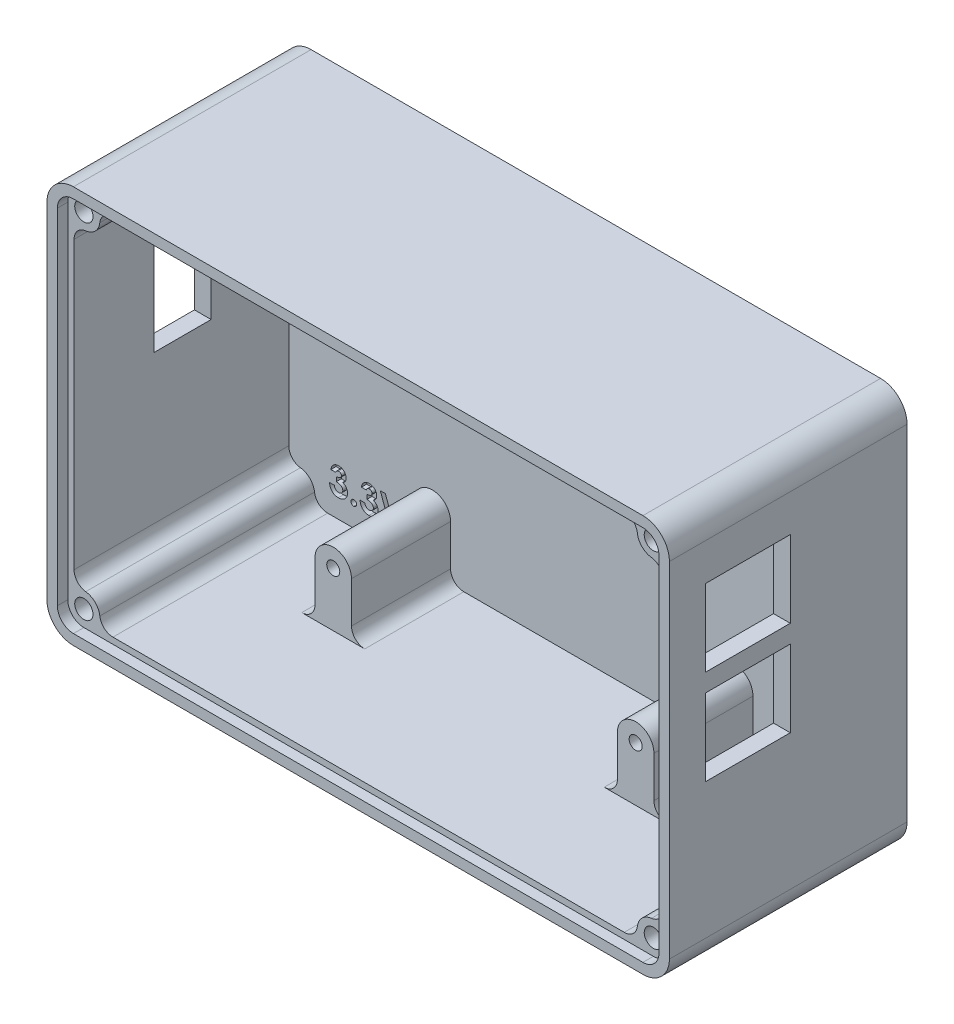
from build123d import *

# Parameters (mm, degrees)
ENCLOSURE_BASE_DEPTH      = 2.400000026
ENCLOSURE_START           = 2.4
ENCLOSURE_WALL_DEPTH      = 43.18
SKETCH6_R                 = 1.25000004
ODROID_MOUNT_SPACER_DEPTH = 19.0000001
SKETCH7_W                 = 11.000000098
SKETCH7_H                 = 26.00000007
POWER_SWITCH_HOLE_DEPTH   = 7.112
SKETCH8_W                 = 0.569871795
SKETCH8_H                 = 2.320192308
LABELING_DEPTH            = 1.000000032
TOP_START                 = -2.000000064
TOP_COVER_GROOVE_DEPTH    = 2.000000064
SKETCH10_R                = 3.079999936
SKETCH10_R_2              = 1.750000056
BOSS_EXTRUDE4_DEPTH       = 43.579999962
FILLET1_R                 = 2.54
FILLET2_R                 = 2.54
CUT_EXTRUDE2_REACH        = 135.344
SKETCH17_W                = 16.256
SKETCH17_H                = 14.732


with BuildPart() as part:
    # Sketch5 → Enclosure Base (new body)
    with BuildSketch(Plane.XY):
        with BuildLine():
            Line((44.569600274, -38.1), (-64.650399726, -38.1))
            ThreePointArc((-64.650399726, -38.1), (-68.242502174, -36.612102448), (-69.730399726, -33.02))
            Line((-69.730399726, -33.02), (-69.730399726, 33.02))
            ThreePointArc((-69.730399726, 33.02), (-68.242502174, 36.612102448), (-64.650399726, 38.1))
            Line((-64.650399726, 38.1), (44.569600274, 38.1))
            ThreePointArc((44.569600274, 38.1), (48.161702723, 36.612102448), (49.649600274, 33.02))
            Line((49.649600274, 33.02), (49.649600274, -33.02))
            ThreePointArc((49.649600274, -33.02), (48.161702723, -36.612102448), (44.569600274, -38.1))
        make_face()
    extrude(amount=ENCLOSURE_BASE_DEPTH)

    # Sketch5<3> → Enclosure Wall (add)
    with BuildSketch(Plane.XY.offset(ENCLOSURE_START)):
        with BuildLine():
            Line((44.569600274, 38.1), (-64.650399726, 38.1))
            ThreePointArc((-64.650399726, 38.1), (-68.242502174, 36.612102448), (-69.730399726, 33.02))
            Line((-69.730399726, 33.02), (-69.730399726, -33.02))
            ThreePointArc((-69.730399726, -33.02), (-68.242502174, -36.612102448), (-64.650399726, -38.1))
            Line((-64.650399726, -38.1), (44.569600274, -38.1))
            ThreePointArc((44.569600274, -38.1), (48.161702723, -36.612102448), (49.649600274, -33.02))
            Line((49.649600274, -33.02), (49.649600274, 33.02))
            ThreePointArc((49.649600274, 33.02), (48.161702723, 36.612102448), (44.569600274, 38.1))
        make_face()
        with BuildLine():
            ThreePointArc((46.449600324, 33.02), (45.898961058, 34.349360784), (44.569600274, 34.90000005))
            Line((44.569600274, 34.90000005), (-64.650399726, 34.90000005))
            ThreePointArc((-64.650399726, 34.90000005), (-65.97976051, 34.349360784), (-66.530399776, 33.02))
            Line((-66.530399776, 33.02), (-66.530399776, -33.02))
            ThreePointArc((-66.530399776, -33.02), (-65.97976051, -34.349360784), (-64.650399726, -34.90000005))
            Line((-64.650399726, -34.90000005), (44.569600274, -34.90000005))
            ThreePointArc((44.569600274, -34.90000005), (45.898961058, -34.349360784), (46.449600324, -33.02))
            Line((46.449600324, -33.02), (46.449600324, 33.02))
        make_face(mode=Mode.SUBTRACT)
    extrude(amount=ENCLOSURE_WALL_DEPTH)

    # Sketch6 → Odroid Mount Spacer (add)
    # profile 1 of 4: a face of its own
    with BuildSketch(Plane.XY.offset(2.400000026)):
        with BuildLine():
            Line((-35.499999993, 24.500000149), (-35.499999993, 34.90000005))
            Line((-35.499999993, 34.90000005), (-42.499999709, 34.90000005))
            Line((-42.499999709, 34.90000005), (-42.499999709, 24.499999895))
            ThreePointArc((-42.499999709, 24.499999895), (-38.999999724, 21.000000291), (-35.499999993, 24.500000149))
        make_face()
        with Locations((-38.999999851, 24.500000149)):
            Circle(SKETCH6_R, mode=Mode.SUBTRACT)
    # profile 2 of 4: a face of its own
    with BuildSketch(Plane.XY.offset(2.400000026)):
        with BuildLine():
            Line((15.500000369, 24.500000149), (15.500000369, 34.90000005))
            Line((15.500000369, 34.90000005), (22.500000085, 34.90000005))
            Line((22.500000085, 34.90000005), (22.500000085, 24.500000149))
            ThreePointArc((22.500000085, 24.500000149), (19.000000227, 21.000000291), (15.500000369, 24.500000149))
        make_face()
        with Locations((19.000000227, 24.500000149)):
            Circle(SKETCH6_R, mode=Mode.SUBTRACT)
    # profile 3 of 4: a face of its own
    with BuildSketch(Plane.XY.offset(2.400000026)):
        with BuildLine():
            Line((15.500000369, -24.500000149), (15.500000369, -34.90000005))
            Line((15.500000369, -34.90000005), (22.500000085, -34.90000005))
            Line((22.500000085, -34.90000005), (22.500000085, -24.500000149))
            ThreePointArc((22.500000085, -24.500000149), (19.000000227, -21.000000037), (15.500000369, -24.500000149))
        make_face()
        with Locations((19.000000227, -24.499999895)):
            Circle(SKETCH6_R, mode=Mode.SUBTRACT)
    # profile 4 of 4: a face of its own
    with BuildSketch(Plane.XY.offset(2.400000026)):
        with BuildLine():
            Line((-42.499999709, -34.90000005), (-42.499999709, -24.499999895))
            ThreePointArc((-42.499999709, -24.499999895), (-38.999999724, -21.000000037), (-35.499999993, -24.500000149))
            Line((-35.499999993, -24.500000149), (-35.499999993, -34.90000005))
            Line((-35.499999993, -34.90000005), (-42.499999709, -34.90000005))
        make_face()
        with Locations((-38.999999851, -24.499999895)):
            Circle(SKETCH6_R, mode=Mode.SUBTRACT)
    extrude(amount=ODROID_MOUNT_SPACER_DEPTH)

    # Sketch7 → Power Switch Hole (cut)
    with BuildSketch(Plane.ZY.offset(69.730399726)):
        with Locations((22.790000013, 13.974684289)):
            Rectangle(SKETCH7_W, SKETCH7_H)
    extrude(amount=-POWER_SWITCH_HOLE_DEPTH, mode=Mode.SUBTRACT)

    # Sketch8 → Labeling (cut)
    # profile 1 of 12: a face of its own
    with BuildSketch(Plane.XY.offset(2.400000026)):
        with BuildLine():
            Line((-57.542707468, -27.351052951), (-58.45450234, -27.351052951))
            add(Edge.make_bspline(
                [(-58.45450234, -27.351052951), (-58.448064721, -27.305475578), (-58.435444196, -27.216124157), (-58.405244969, -27.086765559), (-58.369123433, -26.964060076), (-58.324027542, -26.848396291), (-58.271137398, -26.739568168), (-58.210990834, -26.637202263), (-58.142937645, -26.541737949), (-58.090774155, -26.484229867), (-58.064750737, -26.45554013)],
                knots=[0, 0, 0, 0, 1.111473889, 2.178970933, 3.205615836, 4.199322666, 5.174200091, 6.12565194, 7.064921805, 8, 8, 8, 8], degree=3))
            add(Edge.make_bspline(
                [(-58.064750737, -26.45554013), (-58.027215406, -26.417686101), (-57.953237212, -26.343079787), (-57.829610973, -26.247517341), (-57.700027844, -26.164814542), (-57.561888978, -26.099247165), (-57.41734392, -26.046177969), (-57.265243198, -26.01053127), (-57.10620835, -25.986879371), (-56.997687073, -25.984549577), (-56.942306827, -25.983360643)],
                knots=[0, 0, 0, 0, 1.01925491, 2.00884431, 2.983262333, 3.955970413, 4.92937149, 5.924503185, 6.940838805, 8, 8, 8, 8], degree=3))
            add(Edge.make_bspline(
                [(-56.942306827, -25.983360643), (-56.893070938, -25.984523006), (-56.796283103, -25.986807977), (-56.654029338, -26.005150485), (-56.518402278, -26.037321202), (-56.387968305, -26.079383693), (-56.264645678, -26.136616742), (-56.145712547, -26.203052129), (-56.034491908, -26.284537893), (-55.930723525, -26.376608605), (-55.835392475, -26.476192094), (-55.752835367, -26.582638654), (-55.681859541, -26.693104851), (-55.623384848, -26.808508453), (-55.578425755, -26.929044734), (-55.547222811, -27.054017373), (-55.526799727, -27.183150609), (-55.524765054, -27.270920731), (-55.523733109, -27.315435963)],
                knots=[0, 0, 0, 0, 1.091422571, 2.145516843, 3.172569842, 4.178562979, 5.178154469, 6.181868002, 7.194278174, 8.227918432, 9.254613415, 10.245994977, 11.209837596, 12.161663635, 13.10878368, 14.055455738, 15.013766427, 16, 16, 16, 16], degree=3))
            add(Edge.make_bspline(
                [(-55.523733109, -27.315435963), (-55.525850722, -27.370564372), (-55.53001965, -27.47909526), (-55.564228726, -27.637938279), (-55.617775233, -27.789820551), (-55.69512837, -27.932617015), (-55.791839492, -28.06593906), (-55.910500801, -28.18532933), (-56.047732513, -28.292659702), (-56.150754187, -28.350339057), (-56.20350875, -28.379875066)],
                knots=[0, 0, 0, 0, 0.992805628, 1.954529043, 2.915727527, 3.886831945, 4.871318353, 5.87440735, 6.911542536, 8, 8, 8, 8], degree=3))
            add(Edge.make_bspline(
                [(-56.20350875, -28.379875066), (-56.167298828, -28.391763546), (-56.096147954, -28.415123876), (-55.995015542, -28.461131781), (-55.898850175, -28.511410796), (-55.809307785, -28.569821757), (-55.725497765, -28.634002784), (-55.647931031, -28.704502519), (-55.57614414, -28.781167241), (-55.511308983, -28.864418576), (-55.453765248, -28.952925081), (-55.402134319, -29.044642309), (-55.359639186, -29.140961167), (-55.323640518, -29.240781629), (-55.296233182, -29.34500083), (-55.276935968, -29.453214928), (-55.265781705, -29.565177079), (-55.26408049, -29.641031369), (-55.263220288, -29.679386284)],
                knots=[0, 0, 0, 0, 1.059543567, 2.081955587, 3.086750234, 4.076226789, 5.052108497, 6.020845489, 6.989030705, 7.970690546, 8.952259656, 9.923888338, 10.895517021, 11.877585046, 12.873342345, 13.889638361, 14.932918083, 16, 16, 16, 16], degree=3))
            add(Edge.make_bspline(
                [(-55.263220288, -29.679386284), (-55.264964032, -29.735752436), (-55.26840234, -29.846895009), (-55.290261493, -30.010596645), (-55.330959296, -30.16667161), (-55.384499511, -30.316915783), (-55.455916347, -30.459389566), (-55.539961956, -30.597362539), (-55.643270896, -30.726049836), (-55.758081044, -30.848853616), (-55.885584407, -30.960501314), (-56.023818795, -31.057294844), (-56.169744553, -31.140360915), (-56.324284911, -31.207796318), (-56.487386179, -31.25972929), (-56.658684818, -31.297268837), (-56.838900578, -31.320236153), (-56.961911935, -31.32264384), (-57.024734712, -31.323873463)],
                knots=[0, 0, 0, 0, 1.005138573, 1.981928558, 2.936866704, 3.876260664, 4.820238198, 5.773547, 6.751179199, 7.756627054, 8.768222608, 9.766606018, 10.760583154, 11.757261445, 12.767156078, 13.807575856, 14.880313354, 16, 16, 16, 16], degree=3))
            add(Edge.make_bspline(
                [(-57.024734712, -31.323873463), (-57.084164045, -31.322577034), (-57.200370243, -31.320042037), (-57.370346129, -31.298100354), (-57.531892119, -31.262706639), (-57.685420481, -31.212816262), (-57.830337226, -31.14811697), (-57.967956517, -31.071074631), (-58.095532189, -30.97724562), (-58.214485688, -30.870865557), (-58.322178266, -30.751513167), (-58.41843007, -30.621953189), (-58.50111873, -30.481692958), (-58.570583354, -30.331331726), (-58.626280886, -30.170605712), (-58.670214935, -29.999841763), (-58.700903588, -29.818706257), (-58.710249881, -29.694081176), (-58.71501516, -29.63054013)],
                knots=[0, 0, 0, 0, 1.066544725, 2.085487077, 3.070979577, 4.031932826, 4.977951092, 5.916076795, 6.857635327, 7.814973522, 8.776389752, 9.738577119, 10.707772778, 11.69409279, 12.707140348, 13.757286496, 14.856535458, 16, 16, 16, 16], degree=3))
            Line((-58.71501516, -29.63054013), (-57.803220288, -29.63054013))
            add(Edge.make_bspline(
                [(-57.803220288, -29.63054013), (-57.797442339, -29.662489402), (-57.786188268, -29.724718988), (-57.764237893, -29.814813594), (-57.735633492, -29.89797648), (-57.702559687, -29.974946796), (-57.666834999, -30.046735134), (-57.623671032, -30.110690175), (-57.576230617, -30.168548559), (-57.507773751, -30.237331243), (-57.409909945, -30.30800258), (-57.277761387, -30.369419334), (-57.13075863, -30.405417098), (-57.027989041, -30.409808714), (-56.974870929, -30.412078592)],
                knots=[0, 0, 0, 0, 0.928156231, 1.807827665, 2.648129825, 3.438902246, 4.202261636, 4.936546065, 5.639352463, 6.338805438, 7.70633318, 9.064371875, 10.482673459, 12, 12, 12, 12], degree=3))
            add(Edge.make_bspline(
                [(-56.974870929, -30.412078592), (-56.946684582, -30.411595243), (-56.891473832, -30.41064847), (-56.810377462, -30.400154763), (-56.733121751, -30.382871619), (-56.659562807, -30.359384468), (-56.589232348, -30.329941855), (-56.523474108, -30.291977368), (-56.46094777, -30.247838232), (-56.402333053, -30.198214125), (-56.348171847, -30.144141613), (-56.303106537, -30.084265493), (-56.261920106, -30.023420652), (-56.231458324, -29.957626408), (-56.204767241, -29.890423194), (-56.188430935, -29.819371743), (-56.17609585, -29.745962524), (-56.175378984, -29.695724477), (-56.17501516, -29.67022763)],
                knots=[0, 0, 0, 0, 1.110435564, 2.175094844, 3.216326037, 4.226890168, 5.215276772, 6.21526065, 7.213097102, 8.228249917, 9.239874822, 10.221364777, 11.178138315, 12.128914389, 13.072518965, 14.022636769, 14.996447288, 16, 16, 16, 16], degree=3))
            add(Edge.make_bspline(
                [(-56.17501516, -29.67022763), (-56.175981045, -29.642342484), (-56.177903901, -29.586829547), (-56.193613832, -29.505820088), (-56.218423134, -29.427895518), (-56.252886285, -29.353400923), (-56.298907982, -29.282610875), (-56.353213071, -29.214105111), (-56.420079895, -29.151449236), (-56.493441756, -29.089515801), (-56.578512694, -29.035528526), (-56.671149636, -28.985706202), (-56.773787224, -28.946063015), (-56.883919983, -28.910654305), (-57.003631177, -28.884792334), (-57.132177443, -28.866014022), (-57.269351419, -28.852036479), (-57.363907223, -28.85003117), (-57.412451058, -28.849001669)],
                knots=[0, 0, 0, 0, 0.809814727, 1.612155564, 2.388397, 3.182215007, 3.988903953, 4.837162975, 5.715530372, 6.646997145, 7.623086902, 8.637258368, 9.698941581, 10.815059213, 11.996518529, 13.252603015, 14.589518788, 16, 16, 16, 16], degree=3))
            Line((-57.412451058, -28.849001669), (-57.412451058, -28.002335002))
            add(Edge.make_bspline(
                [(-57.412451058, -28.002335002), (-57.352011096, -27.997187741), (-57.238939898, -27.987558236), (-57.081991012, -27.965039304), (-56.949860282, -27.934939044), (-56.839371943, -27.898624708), (-56.747629506, -27.851987641), (-56.667483819, -27.800502379), (-56.598458563, -27.74070977), (-56.540122962, -27.674392824), (-56.493456296, -27.603174642), (-56.460428349, -27.528162166), (-56.438618418, -27.451676376), (-56.436551928, -27.3993624), (-56.435527981, -27.373440771)],
                knots=[0, 0, 0, 0, 1.70044513, 3.18119609, 4.440695891, 5.496282586, 6.431922213, 7.318171381, 8.16090191, 8.983045123, 9.787564368, 10.536848927, 11.275007137, 12, 12, 12, 12], degree=3))
            add(Edge.make_bspline(
                [(-56.435527981, -27.373440771), (-56.437294583, -27.340367587), (-56.440742618, -27.275815735), (-56.467521921, -27.183428435), (-56.514007757, -27.101072815), (-56.5763371, -27.028922173), (-56.652287572, -26.96865655), (-56.741314839, -26.924904735), (-56.841487005, -26.89919859), (-56.911963522, -26.896533729), (-56.948412596, -26.895155515)],
                knots=[0, 0, 0, 0, 1.009664648, 1.970651636, 2.907870547, 3.878035693, 4.867062054, 5.849714035, 6.887914197, 8, 8, 8, 8], degree=3))
            add(Edge.make_bspline(
                [(-56.948412596, -26.895155515), (-56.981449584, -26.896781662), (-57.047005087, -26.900008437), (-57.142866853, -26.924092229), (-57.233903593, -26.964634297), (-57.318230194, -27.020539418), (-57.394629382, -27.087679099), (-57.457331074, -27.167192115), (-57.509483368, -27.254314703), (-57.531589352, -27.318680455), (-57.542707468, -27.351052951)],
                knots=[0, 0, 0, 0, 0.98818071, 1.960853194, 2.938124878, 3.957524365, 4.978590984, 5.968022688, 6.978025184, 8, 8, 8, 8], degree=3))
        make_face()
    # profile 2 of 12: a face of its own
    with BuildSketch(Plane.XY.offset(2.400000026)):
        with BuildLine():
            add(Edge.make_bspline(
                [(-54.058348494, -30.151565771), (-54.021540416, -30.15358387), (-53.949071667, -30.157557157), (-53.844364207, -30.187209385), (-53.749865121, -30.240483837), (-53.665370312, -30.309971126), (-53.593923629, -30.393573612), (-53.542283582, -30.488912026), (-53.51012603, -30.593216034), (-53.506575814, -30.665912778), (-53.50475875, -30.703120258)],
                knots=[0, 0, 0, 0, 1.016957001, 2.002212695, 2.9757545, 3.99499976, 5.013036768, 5.994806404, 6.97370641, 8, 8, 8, 8], degree=3))
            add(Edge.make_bspline(
                [(-53.50475875, -30.703120258), (-53.50656391, -30.740333715), (-53.510090869, -30.813042134), (-53.542506109, -30.917549386), (-53.593846462, -31.013671394), (-53.665376044, -31.098169736), (-53.749515199, -31.168966578), (-53.844581477, -31.221749762), (-53.948872202, -31.253084085), (-54.021505307, -31.256840045), (-54.058348494, -31.258745258)],
                knots=[0, 0, 0, 0, 1.023218912, 1.999186227, 2.986238111, 4.008388923, 5.030539734, 6.0011649, 6.986089706, 8, 8, 8, 8], degree=3))
            add(Edge.make_bspline(
                [(-54.058348494, -31.258745258), (-54.09520041, -31.256855538), (-54.167850726, -31.25313012), (-54.272303563, -31.221485644), (-54.368071694, -31.169318979), (-54.452231989, -31.09808386), (-54.524081134, -31.01397061), (-54.573961833, -30.917246104), (-54.606679012, -30.813081534), (-54.610157755, -30.740347054), (-54.611938237, -30.703120258)],
                knots=[0, 0, 0, 0, 1.013427518, 1.99788335, 2.976245624, 3.997909735, 5.019573847, 6.001765691, 6.977268297, 8, 8, 8, 8], degree=3))
            add(Edge.make_bspline(
                [(-54.611938237, -30.703120258), (-54.610146008, -30.665899207), (-54.606644315, -30.593175947), (-54.574183726, -30.489218801), (-54.524001191, -30.39327277), (-54.452237981, -30.310057181), (-54.367719969, -30.240134187), (-54.272522052, -30.187469883), (-54.167651361, -30.157510782), (-54.095165343, -30.153568249), (-54.058348494, -30.151565771)],
                knots=[0, 0, 0, 0, 1.025808215, 2.00424526, 2.981110158, 3.998665696, 5.017428914, 5.998734231, 6.983523959, 8, 8, 8, 8], degree=3))
        make_face()
    # profile 3 of 12: a face of its own
    with BuildSketch(Plane.XY.offset(2.400000026)):
        with BuildLine():
            Line((-51.681169006, -27.351052951), (-52.592963878, -27.351052951))
            add(Edge.make_bspline(
                [(-52.592963878, -27.351052951), (-52.58652626, -27.305475578), (-52.573905735, -27.216124157), (-52.543706507, -27.086765559), (-52.507584972, -26.964060076), (-52.46248908, -26.848396291), (-52.409598936, -26.739568168), (-52.349452373, -26.637202263), (-52.281399184, -26.541737949), (-52.229235693, -26.484229867), (-52.203212276, -26.45554013)],
                knots=[0, 0, 0, 0, 1.111473889, 2.178970933, 3.205615836, 4.199322666, 5.174200091, 6.12565194, 7.064921805, 8, 8, 8, 8], degree=3))
            add(Edge.make_bspline(
                [(-52.203212276, -26.45554013), (-52.165676944, -26.417686101), (-52.09169875, -26.343079787), (-51.968072511, -26.247517341), (-51.838489382, -26.164814542), (-51.700350516, -26.099247165), (-51.555805459, -26.046177969), (-51.403704737, -26.01053127), (-51.244669889, -25.986879371), (-51.136148612, -25.984549577), (-51.080768365, -25.983360643)],
                knots=[0, 0, 0, 0, 1.01925491, 2.00884431, 2.983262333, 3.955970413, 4.92937149, 5.924503185, 6.940838805, 8, 8, 8, 8], degree=3))
            add(Edge.make_bspline(
                [(-51.080768365, -25.983360643), (-51.031532477, -25.984523006), (-50.934744641, -25.986807977), (-50.792490876, -26.005150485), (-50.656863816, -26.037321202), (-50.526429843, -26.079383693), (-50.403107216, -26.136616742), (-50.284174085, -26.203052129), (-50.172953446, -26.284537893), (-50.069185064, -26.376608605), (-49.973854013, -26.476192094), (-49.891296906, -26.582638654), (-49.820321079, -26.693104851), (-49.761846386, -26.808508453), (-49.716887293, -26.929044734), (-49.68568435, -27.054017373), (-49.665261265, -27.183150609), (-49.663226592, -27.270920731), (-49.662194647, -27.315435963)],
                knots=[0, 0, 0, 0, 1.091422571, 2.145516843, 3.172569842, 4.178562979, 5.178154469, 6.181868002, 7.194278174, 8.227918432, 9.254613415, 10.245994977, 11.209837596, 12.161663635, 13.10878368, 14.055455738, 15.013766427, 16, 16, 16, 16], degree=3))
            add(Edge.make_bspline(
                [(-49.662194647, -27.315435963), (-49.66431226, -27.370564372), (-49.668481189, -27.47909526), (-49.702690265, -27.637938279), (-49.756236771, -27.789820551), (-49.833589908, -27.932617015), (-49.930301031, -28.06593906), (-50.048962339, -28.18532933), (-50.186194052, -28.292659702), (-50.289215726, -28.350339057), (-50.341970288, -28.379875066)],
                knots=[0, 0, 0, 0, 0.992805628, 1.954529043, 2.915727527, 3.886831945, 4.871318353, 5.87440735, 6.911542536, 8, 8, 8, 8], degree=3))
            add(Edge.make_bspline(
                [(-50.341970288, -28.379875066), (-50.305760366, -28.391763546), (-50.234609492, -28.415123876), (-50.133477081, -28.461131781), (-50.037311714, -28.511410796), (-49.947769323, -28.569821757), (-49.863959304, -28.634002784), (-49.78639257, -28.704502519), (-49.714605678, -28.781167241), (-49.649770522, -28.864418576), (-49.592226787, -28.952925081), (-49.540595858, -29.044642309), (-49.498100725, -29.140961167), (-49.462102057, -29.240781629), (-49.434694721, -29.34500083), (-49.415397507, -29.453214928), (-49.404243244, -29.565177079), (-49.402542028, -29.641031369), (-49.401681827, -29.679386284)],
                knots=[0, 0, 0, 0, 1.059543567, 2.081955587, 3.086750234, 4.076226789, 5.052108497, 6.020845489, 6.989030705, 7.970690546, 8.952259656, 9.923888338, 10.895517021, 11.877585046, 12.873342345, 13.889638361, 14.932918083, 16, 16, 16, 16], degree=3))
            add(Edge.make_bspline(
                [(-49.401681827, -29.679386284), (-49.403425571, -29.735752436), (-49.406863879, -29.846895009), (-49.428723031, -30.010596645), (-49.469420835, -30.16667161), (-49.522961049, -30.316915783), (-49.594377885, -30.459389566), (-49.678423494, -30.597362539), (-49.781732434, -30.726049836), (-49.896542583, -30.848853616), (-50.024045946, -30.960501314), (-50.162280334, -31.057294844), (-50.308206092, -31.140360915), (-50.46274645, -31.207796318), (-50.625847718, -31.25972929), (-50.797146357, -31.297268837), (-50.977362117, -31.320236153), (-51.100373473, -31.32264384), (-51.16319625, -31.323873463)],
                knots=[0, 0, 0, 0, 1.005138573, 1.981928558, 2.936866704, 3.876260664, 4.820238198, 5.773547, 6.751179199, 7.756627054, 8.768222608, 9.766606018, 10.760583154, 11.757261445, 12.767156078, 13.807575856, 14.880313354, 16, 16, 16, 16], degree=3))
            add(Edge.make_bspline(
                [(-51.16319625, -31.323873463), (-51.222625584, -31.322577034), (-51.338831782, -31.320042037), (-51.508807667, -31.298100354), (-51.670353657, -31.262706639), (-51.823882019, -31.212816262), (-51.968798765, -31.14811697), (-52.106418055, -31.071074631), (-52.233993728, -30.97724562), (-52.352947227, -30.870865557), (-52.460639805, -30.751513167), (-52.556891608, -30.621953189), (-52.639580269, -30.481692958), (-52.709044893, -30.331331726), (-52.764742424, -30.170605712), (-52.808676474, -29.999841763), (-52.839365126, -29.818706257), (-52.84871142, -29.694081176), (-52.853476699, -29.63054013)],
                knots=[0, 0, 0, 0, 1.066544725, 2.085487077, 3.070979577, 4.031932826, 4.977951092, 5.916076795, 6.857635327, 7.814973522, 8.776389752, 9.738577119, 10.707772778, 11.69409279, 12.707140348, 13.757286496, 14.856535458, 16, 16, 16, 16], degree=3))
            Line((-52.853476699, -29.63054013), (-51.941681827, -29.63054013))
            add(Edge.make_bspline(
                [(-51.941681827, -29.63054013), (-51.935903878, -29.662489402), (-51.924649807, -29.724718988), (-51.902699432, -29.814813594), (-51.87409503, -29.89797648), (-51.841021226, -29.974946796), (-51.805296537, -30.046735134), (-51.762132571, -30.110690175), (-51.714692155, -30.168548559), (-51.646235289, -30.237331243), (-51.548371484, -30.30800258), (-51.416222925, -30.369419334), (-51.269220168, -30.405417098), (-51.16645058, -30.409808714), (-51.113332468, -30.412078592)],
                knots=[0, 0, 0, 0, 0.928156231, 1.807827665, 2.648129825, 3.438902246, 4.202261636, 4.936546065, 5.639352463, 6.338805438, 7.70633318, 9.064371875, 10.482673459, 12, 12, 12, 12], degree=3))
            add(Edge.make_bspline(
                [(-51.113332468, -30.412078592), (-51.08514612, -30.411595243), (-51.029935371, -30.41064847), (-50.948839001, -30.400154763), (-50.87158329, -30.382871619), (-50.798024345, -30.359384468), (-50.727693886, -30.329941855), (-50.661935646, -30.291977368), (-50.599409309, -30.247838232), (-50.540794592, -30.198214125), (-50.486633385, -30.144141613), (-50.441568076, -30.084265493), (-50.400381644, -30.023420652), (-50.369919863, -29.957626408), (-50.343228779, -29.890423194), (-50.326892473, -29.819371743), (-50.314557388, -29.745962524), (-50.313840523, -29.695724477), (-50.313476699, -29.67022763)],
                knots=[0, 0, 0, 0, 1.110435564, 2.175094844, 3.216326037, 4.226890168, 5.215276772, 6.21526065, 7.213097102, 8.228249917, 9.239874822, 10.221364777, 11.178138315, 12.128914389, 13.072518965, 14.022636769, 14.996447288, 16, 16, 16, 16], degree=3))
            add(Edge.make_bspline(
                [(-50.313476699, -29.67022763), (-50.314442584, -29.642342484), (-50.316365439, -29.586829547), (-50.33207537, -29.505820088), (-50.356884672, -29.427895518), (-50.391347823, -29.353400923), (-50.43736952, -29.282610875), (-50.491674609, -29.214105111), (-50.558541433, -29.151449236), (-50.631903294, -29.089515801), (-50.716974232, -29.035528526), (-50.809611174, -28.985706202), (-50.912248762, -28.946063015), (-51.022381521, -28.910654305), (-51.142092715, -28.884792334), (-51.270638982, -28.866014022), (-51.407812957, -28.852036479), (-51.502368761, -28.85003117), (-51.550912596, -28.849001669)],
                knots=[0, 0, 0, 0, 0.809814727, 1.612155564, 2.388397, 3.182215007, 3.988903953, 4.837162975, 5.715530372, 6.646997145, 7.623086902, 8.637258368, 9.698941581, 10.815059213, 11.996518529, 13.252603015, 14.589518788, 16, 16, 16, 16], degree=3))
            Line((-51.550912596, -28.849001669), (-51.550912596, -28.002335002))
            add(Edge.make_bspline(
                [(-51.550912596, -28.002335002), (-51.490472635, -27.997187741), (-51.377401437, -27.987558236), (-51.220452551, -27.965039304), (-51.088321821, -27.934939044), (-50.977833482, -27.898624708), (-50.886091044, -27.851987641), (-50.805945358, -27.800502379), (-50.736920101, -27.74070977), (-50.6785845, -27.674392824), (-50.631917834, -27.603174642), (-50.598889887, -27.528162166), (-50.577079956, -27.451676376), (-50.575013467, -27.3993624), (-50.573989519, -27.373440771)],
                knots=[0, 0, 0, 0, 1.70044513, 3.18119609, 4.440695891, 5.496282586, 6.431922213, 7.318171381, 8.16090191, 8.983045123, 9.787564368, 10.536848927, 11.275007137, 12, 12, 12, 12], degree=3))
            add(Edge.make_bspline(
                [(-50.573989519, -27.373440771), (-50.575756122, -27.340367587), (-50.579204156, -27.275815735), (-50.605983459, -27.183428435), (-50.652469295, -27.101072815), (-50.714798638, -27.028922173), (-50.79074911, -26.96865655), (-50.879776378, -26.924904735), (-50.979948544, -26.89919859), (-51.05042506, -26.896533729), (-51.086874135, -26.895155515)],
                knots=[0, 0, 0, 0, 1.009664648, 1.970651636, 2.907870547, 3.878035693, 4.867062054, 5.849714035, 6.887914197, 8, 8, 8, 8], degree=3))
            add(Edge.make_bspline(
                [(-51.086874135, -26.895155515), (-51.119911122, -26.896781662), (-51.185466625, -26.900008437), (-51.281328392, -26.924092229), (-51.372365132, -26.964634297), (-51.456691732, -27.020539418), (-51.533090921, -27.087679099), (-51.595792612, -27.167192115), (-51.647944907, -27.254314703), (-51.670050891, -27.318680455), (-51.681169006, -27.351052951)],
                knots=[0, 0, 0, 0, 0.98818071, 1.960853194, 2.938124878, 3.957524365, 4.978590984, 5.968022688, 6.978025184, 8, 8, 8, 8], degree=3))
        make_face()
    # profile 4 of 12: a face of its own
    with BuildSketch(Plane.XY.offset(2.400000026)):
        Polygon((-48.978348494, -26.113617053), (-48.004478301, -26.113617053), (-46.698861314, -29.722126669), (-45.390191442, -26.113617053), (-44.419374135, -26.113617053), (-46.261281186, -31.193617053), (-47.139494327, -31.193617053), align=None)
    # profile 5 of 12: a face of its own
    with BuildSketch(Plane.XY.offset(2.400000026)):
        with BuildLine():
            Line((-57.771673814, 31.036382947), (-55.458604904, 31.036382947))
            Line((-55.458604904, 31.036382947), (-55.458604904, 30.18971628))
            Line((-55.458604904, 30.18971628), (-57.049157788, 30.18971628))
            Line((-57.049157788, 30.18971628), (-57.247595288, 29.229075255))
            add(Edge.make_bspline(
                [(-57.247595288, 29.229075255), (-57.220555338, 29.236606222), (-57.167227002, 29.251458837), (-57.086887796, 29.266354131), (-57.00902791, 29.276008787), (-56.957936727, 29.277296589), (-56.933148173, 29.277921408)],
                knots=[0, 0, 0, 0, 1.05461699, 2.079921384, 3.068411212, 4, 4, 4, 4], degree=3))
            add(Edge.make_bspline(
                [(-56.933148173, 29.277921408), (-56.879131317, 29.276683643), (-56.772652194, 29.274243736), (-56.61688675, 29.251081056), (-56.467732134, 29.214600538), (-56.325644778, 29.162571792), (-56.190763482, 29.094855035), (-56.062924743, 29.012936742), (-55.941971659, 28.916673034), (-55.830052868, 28.806003642), (-55.727217208, 28.684486144), (-55.637807467, 28.553052111), (-55.561445968, 28.413575666), (-55.500710672, 28.265189826), (-55.452773199, 28.108826554), (-55.41813251, 27.944385647), (-55.39764774, 27.771672218), (-55.394885494, 27.653842194), (-55.393476699, 27.593746729)],
                knots=[0, 0, 0, 0, 1.01440847, 1.999622559, 2.951875003, 3.895578053, 4.836219714, 5.782137149, 6.743708247, 7.735272588, 8.734977101, 9.730283169, 10.717124674, 11.717316708, 12.737475749, 13.78628267, 14.87096371, 16, 16, 16, 16], degree=3))
            add(Edge.make_bspline(
                [(-55.393476699, 27.593746729), (-55.39519827, 27.532969041), (-55.398595433, 27.413036896), (-55.420758808, 27.236694221), (-55.459877563, 27.067797748), (-55.513611087, 26.905895344), (-55.584401565, 26.752176956), (-55.669536803, 26.605050174), (-55.77045621, 26.465607074), (-55.886169418, 26.335277117), (-56.011964855, 26.216153034), (-56.1459073, 26.111359349), (-56.287055767, 26.023176313), (-56.435413662, 25.951909511), (-56.59012981, 25.895524487), (-56.751251166, 25.85447888), (-56.919560762, 25.830941505), (-57.033821109, 25.827749163), (-57.091898173, 25.826126537)],
                knots=[0, 0, 0, 0, 1.06808661, 2.107647099, 3.116961351, 4.110378221, 5.100014249, 6.085620622, 7.093190682, 8.119403071, 9.144090782, 10.133780668, 11.103064255, 12.062861538, 13.020824475, 13.992378307, 14.979551724, 16, 16, 16, 16], degree=3))
            add(Edge.make_bspline(
                [(-57.091898173, 25.826126537), (-57.143834763, 25.827453946), (-57.246264587, 25.830071875), (-57.397139221, 25.846163047), (-57.542599122, 25.87461239), (-57.681872058, 25.915785956), (-57.816423412, 25.966461216), (-57.944697733, 26.029840205), (-58.067399909, 26.104716102), (-58.184181513, 26.189722421), (-58.29314501, 26.285478741), (-58.392595345, 26.390300533), (-58.483134601, 26.502866567), (-58.562825381, 26.624565567), (-58.631417878, 26.75521773), (-58.692247104, 26.893283289), (-58.742036435, 27.04020409), (-58.767303086, 27.142057752), (-58.780143365, 27.193818844)],
                knots=[0, 0, 0, 0, 1.054957082, 2.080596141, 3.077793124, 4.061112343, 5.027190972, 5.994718051, 6.962465889, 7.943658696, 8.924948258, 9.904494768, 10.875059, 11.855380583, 12.854004648, 13.869083016, 14.917087635, 16, 16, 16, 16], degree=3))
            Line((-58.780143365, 27.193818844), (-57.738092083, 27.193818844))
            add(Edge.make_bspline(
                [(-57.738092083, 27.193818844), (-57.719043361, 27.157950515), (-57.682024342, 27.088244511), (-57.611605985, 26.995699317), (-57.532777105, 26.916780751), (-57.44624878, 26.850717763), (-57.351460363, 26.801224496), (-57.252274301, 26.763691092), (-57.147444562, 26.742001928), (-57.076050881, 26.739290567), (-57.039999135, 26.737921408)],
                knots=[0, 0, 0, 0, 1.104910296, 2.147267069, 3.153527244, 4.136738762, 5.099945312, 6.05603338, 7.018353, 8, 8, 8, 8], degree=3))
            add(Edge.make_bspline(
                [(-57.039999135, 26.737921408), (-57.014871551, 26.738866824), (-56.965432606, 26.740726946), (-56.892592139, 26.750567459), (-56.823062713, 26.769205166), (-56.756327393, 26.795014058), (-56.692206912, 26.827200662), (-56.631620458, 26.867834152), (-56.573513937, 26.914604805), (-56.518771966, 26.968274288), (-56.469191519, 27.028103278), (-56.42571489, 27.092393606), (-56.386840788, 27.159716727), (-56.358046146, 27.232739479), (-56.334465769, 27.309281378), (-56.317100226, 27.389919801), (-56.306722356, 27.474748928), (-56.305761642, 27.532659396), (-56.305271571, 27.562200255)],
                knots=[0, 0, 0, 0, 0.978869489, 1.925942215, 2.855067702, 3.774946051, 4.70828698, 5.642468714, 6.60995405, 7.609372294, 8.622401667, 9.629904756, 10.629323, 11.642352373, 12.678539694, 13.745912462, 14.850161547, 16, 16, 16, 16], degree=3))
            add(Edge.make_bspline(
                [(-56.305271571, 27.562200255), (-56.305840356, 27.591055403), (-56.30694751, 27.64722265), (-56.316106109, 27.729696288), (-56.332490668, 27.807948845), (-56.354814769, 27.882579676), (-56.383392284, 27.953135588), (-56.418315917, 28.020036563), (-56.459734866, 28.082944441), (-56.507871501, 28.14057848), (-56.559203913, 28.193442059), (-56.614351418, 28.239676124), (-56.672817166, 28.278047188), (-56.732784407, 28.311546243), (-56.796646816, 28.335926126), (-56.862968385, 28.352715651), (-56.931679368, 28.365035129), (-56.978545638, 28.365758944), (-57.002346891, 28.366126537)],
                knots=[0, 0, 0, 0, 1.166249705, 2.270133367, 3.348514167, 4.393962215, 5.415026464, 6.420877785, 7.440098956, 8.453121383, 9.451844239, 10.415694839, 11.355045125, 12.27538808, 13.187007209, 14.108269027, 15.039275622, 16, 16, 16, 16], degree=3))
            add(Edge.make_bspline(
                [(-57.002346891, 28.366126537), (-57.028200584, 28.365145532), (-57.080016931, 28.36317939), (-57.157003054, 28.347181414), (-57.233060938, 28.321290687), (-57.308613544, 28.285570325), (-57.38291088, 28.238823643), (-57.457913691, 28.183995145), (-57.53111147, 28.11710102), (-57.577652655, 28.067278123), (-57.601729904, 28.041503139)],
                knots=[0, 0, 0, 0, 0.88288272, 1.769486374, 2.674910571, 3.623812639, 4.617874466, 5.670434592, 6.794841017, 8, 8, 8, 8], degree=3))
            Line((-57.601729904, 28.041503139), (-58.369021571, 28.217552819))
            Line((-58.369021571, 28.217552819), (-57.771673814, 31.036382947))
        make_face()
    # profile 6 of 12: a face of its own
    with BuildSketch(Plane.XY.offset(2.400000026)):
        with BuildLine():
            add(Edge.make_bspline(
                [(-54.058348494, 26.998434229), (-54.021540416, 26.99641613), (-53.949071667, 26.992442843), (-53.844364207, 26.962790615), (-53.749865121, 26.909516163), (-53.665370312, 26.840028874), (-53.593923629, 26.756426388), (-53.542283582, 26.661087974), (-53.51012603, 26.556783966), (-53.506575814, 26.484087222), (-53.50475875, 26.446879742)],
                knots=[0, 0, 0, 0, 1.016957001, 2.002212695, 2.9757545, 3.99499976, 5.013036768, 5.994806404, 6.97370641, 8, 8, 8, 8], degree=3))
            add(Edge.make_bspline(
                [(-53.50475875, 26.446879742), (-53.50656391, 26.409666285), (-53.510090869, 26.336957866), (-53.542506109, 26.232450614), (-53.593846462, 26.136328606), (-53.665376044, 26.051830264), (-53.749515199, 25.981033422), (-53.844581477, 25.928250238), (-53.948872202, 25.896915915), (-54.021505307, 25.893159955), (-54.058348494, 25.891254742)],
                knots=[0, 0, 0, 0, 1.023218912, 1.999186227, 2.986238111, 4.008388923, 5.030539734, 6.0011649, 6.986089706, 8, 8, 8, 8], degree=3))
            add(Edge.make_bspline(
                [(-54.058348494, 25.891254742), (-54.09520041, 25.893144462), (-54.167850726, 25.89686988), (-54.272303563, 25.928514356), (-54.368071694, 25.980681021), (-54.452231989, 26.05191614), (-54.524081134, 26.13602939), (-54.573961833, 26.232753896), (-54.606679012, 26.336918466), (-54.610157755, 26.409652946), (-54.611938237, 26.446879742)],
                knots=[0, 0, 0, 0, 1.013427518, 1.99788335, 2.976245624, 3.997909735, 5.019573847, 6.001765691, 6.977268297, 8, 8, 8, 8], degree=3))
            add(Edge.make_bspline(
                [(-54.611938237, 26.446879742), (-54.610146008, 26.484100793), (-54.606644315, 26.556824053), (-54.574183726, 26.660781199), (-54.524001191, 26.75672723), (-54.452237981, 26.839942819), (-54.367719969, 26.909865813), (-54.272522052, 26.962530117), (-54.167651361, 26.992489218), (-54.095165343, 26.996431751), (-54.058348494, 26.998434229)],
                knots=[0, 0, 0, 0, 1.025808215, 2.00424526, 2.981110158, 3.998665696, 5.017428914, 5.998734231, 6.983523959, 8, 8, 8, 8], degree=3))
        make_face()
    # profile 7 of 12: a face of its own
    with BuildSketch(Plane.XY.offset(2.400000026)):
        with BuildLine():
            add(Edge.make_bspline(
                [(-51.142843686, 31.166639357), (-51.09870903, 31.165984166), (-51.011928504, 31.164695884), (-50.884117124, 31.150742748), (-50.760999428, 31.12966345), (-50.642093763, 31.10026518), (-50.528256025, 31.061357616), (-50.41865768, 31.01478593), (-50.314603264, 30.958107339), (-50.214765751, 30.894085961), (-50.119183599, 30.821604684), (-50.030154059, 30.738972286), (-49.94605126, 30.648090142), (-49.86869572, 30.547584277), (-49.796374376, 30.438368898), (-49.729324865, 30.320426687), (-49.668060466, 30.193180396), (-49.611894552, 30.056400399), (-49.561670814, 29.908036423), (-49.519367422, 29.746386669), (-49.483085185, 29.57141422), (-49.452460417, 29.382683545), (-49.429313042, 29.179943775), (-49.413711245, 28.9633296), (-49.403004553, 28.733258621), (-49.402130748, 28.57543182), (-49.401681827, 28.49434769)],
                knots=[0, 0, 0, 0, 0.879237366, 1.728815576, 2.559023295, 3.367336655, 4.166867292, 4.954216142, 5.737608147, 6.525189134, 7.316157332, 8.124696809, 8.942788509, 9.781158001, 10.649253743, 11.551476218, 12.482711956, 13.461909668, 14.496590415, 15.601789533, 16.789733467, 18.056700938, 19.410929216, 20.8549011, 22.384193279, 24, 24, 24, 24], degree=3))
            add(Edge.make_bspline(
                [(-49.401681827, 28.49434769), (-49.402166989, 28.412249107), (-49.403109651, 28.252733033), (-49.413266165, 28.020557708), (-49.430756161, 27.802370784), (-49.453298531, 27.598194835), (-49.484175412, 27.408137682), (-49.520336531, 27.231707206), (-49.563307669, 27.068967358), (-49.615185761, 26.920284825), (-49.671011701, 26.783264612), (-49.732443684, 26.656266421), (-49.79841096, 26.538946271), (-49.867400437, 26.429534226), (-49.943194373, 26.3312557), (-50.022103663, 26.240768707), (-50.107564158, 26.161520014), (-50.195977642, 26.089425498), (-50.290583057, 26.027121369), (-50.390404764, 25.972631204), (-50.497222409, 25.928433209), (-50.609088888, 25.889992154), (-50.727910989, 25.862395624), (-50.851800645, 25.840498684), (-50.982156545, 25.828397092), (-51.070908091, 25.82689581), (-51.116385353, 25.826126537)],
                knots=[0, 0, 0, 0, 1.643780988, 3.193836972, 4.651895693, 6.025988579, 7.305620092, 8.505800249, 9.631074763, 10.672816429, 11.65661981, 12.592235626, 13.49536222, 14.350718032, 15.179365177, 15.97804903, 16.751647189, 17.51006938, 18.259804725, 19.016521909, 19.783502495, 20.571750527, 21.382245291, 22.22305063, 23.089471752, 24, 24, 24, 24], degree=3))
            add(Edge.make_bspline(
                [(-51.116385353, 25.826126537), (-51.161861386, 25.826910649), (-51.250948267, 25.828446713), (-51.381656662, 25.840408704), (-51.506202871, 25.862484329), (-51.625965046, 25.890204019), (-51.740109661, 25.928348155), (-51.849184037, 25.973868522), (-51.952349485, 26.028018695), (-52.049891655, 26.090467987), (-52.14147751, 26.162080136), (-52.228530293, 26.242089169), (-52.31085744, 26.330292284), (-52.387206549, 26.427677429), (-52.458827998, 26.532944715), (-52.524974889, 26.647296244), (-52.585607469, 26.770565522), (-52.642622337, 26.902924374), (-52.69216104, 27.047222334), (-52.736248185, 27.204747966), (-52.772363215, 27.376814374), (-52.801409339, 27.563366281), (-52.824599748, 27.764008469), (-52.841850746, 27.978837781), (-52.852063675, 28.20795428), (-52.85299645, 28.365437463), (-52.853476699, 28.446519165)],
                knots=[0, 0, 0, 0, 0.917216111, 1.796812873, 2.643793957, 3.46689424, 4.273913431, 5.068098542, 5.848489301, 6.620921603, 7.401012384, 8.190319798, 9.003608147, 9.831726257, 10.68377682, 11.569763213, 12.493818149, 13.453288342, 14.474581811, 15.568529029, 16.750744269, 18.018426408, 19.375425659, 20.823733699, 22.36466933, 24, 24, 24, 24], degree=3))
            add(Edge.make_bspline(
                [(-52.853476699, 28.446519165), (-52.852606774, 28.559175807), (-52.850928242, 28.776548249), (-52.829656656, 29.090588227), (-52.798435363, 29.380863788), (-52.752578678, 29.64688937), (-52.695877523, 29.889650257), (-52.62326874, 30.107547265), (-52.540608923, 30.30359549), (-52.47017214, 30.419735638), (-52.436249135, 30.475669806)],
                knots=[0, 0, 0, 0, 1.288568992, 2.486310467, 3.599230591, 4.627010532, 5.572937695, 6.447898582, 7.252493626, 8, 8, 8, 8], degree=3))
            add(Edge.make_bspline(
                [(-52.436249135, 30.475669806), (-52.39680508, 30.530619515), (-52.319684181, 30.638057024), (-52.184836132, 30.77910239), (-52.039959462, 30.899731294), (-51.882078484, 30.997213796), (-51.713690153, 31.074088504), (-51.533348769, 31.128384245), (-51.341720303, 31.160019474), (-51.210125838, 31.164399778), (-51.142843686, 31.166639357)],
                knots=[0, 0, 0, 0, 1.058512271, 2.069600068, 3.047294572, 4.004278952, 4.967380941, 5.939006123, 6.946246673, 8, 8, 8, 8], degree=3))
        make_face()
        with BuildLine():
            add(Edge.make_bspline(
                [(-51.120455865, 30.254844485), (-51.160353961, 30.252953395), (-51.238575406, 30.249245854), (-51.352078451, 30.217774061), (-51.459104735, 30.169164181), (-51.540516771, 30.110669791), (-51.601452871, 30.054595902), (-51.64402936, 30.003850857), (-51.685087674, 29.947223044), (-51.721352444, 29.882157141), (-51.755595854, 29.810991042), (-51.789061986, 29.733401697), (-51.816495428, 29.647483342), (-51.843448056, 29.55469918), (-51.867061074, 29.452483974), (-51.886843606, 29.340002227), (-51.90451756, 29.216522461), (-51.916845353, 29.081963795), (-51.928338556, 28.936467013), (-51.936577428, 28.779708002), (-51.940021894, 28.611729055), (-51.941116785, 28.496044446), (-51.941681827, 28.436342883)],
                knots=[0, 0, 0, 0, 1.076674018, 2.110852608, 3.161083442, 4.239746716, 4.804137807, 5.395870207, 6.026861976, 6.692161227, 7.405688833, 8.16177676, 8.973626916, 9.841385931, 10.773283133, 11.807421078, 12.927755683, 14.143907515, 15.458935494, 16.872852025, 18.386167141, 20, 20, 20, 20], degree=3))
            add(Edge.make_bspline(
                [(-51.941681827, 28.436342883), (-51.940751836, 28.358996621), (-51.938968509, 28.210679431), (-51.929628277, 27.997394146), (-51.910906558, 27.803287363), (-51.887620518, 27.627043547), (-51.854914325, 27.469805688), (-51.817283733, 27.330086169), (-51.770813298, 27.209666074), (-51.717107755, 27.10680386), (-51.657626448, 27.019299187), (-51.593056871, 26.944919821), (-51.525597389, 26.8805108), (-51.453142372, 26.828192145), (-51.375864675, 26.78809754), (-51.294409425, 26.759257986), (-51.208724859, 26.741604094), (-51.150048951, 26.739156066), (-51.120455865, 26.737921408)],
                knots=[0, 0, 0, 0, 1.771748488, 3.397459088, 4.888034009, 6.237357457, 7.467047327, 8.564189669, 9.548206622, 10.417051504, 11.216568818, 11.965764335, 12.669334354, 13.348544111, 14.005342236, 14.656555988, 15.322436492, 16, 16, 16, 16], degree=3))
            add(Edge.make_bspline(
                [(-51.120455865, 26.737921408), (-51.091878321, 26.738766253), (-51.035927041, 26.740420354), (-50.954337545, 26.757399479), (-50.87718072, 26.785003847), (-50.804689526, 26.824052165), (-50.736604674, 26.873708075), (-50.673258919, 26.934189787), (-50.615130002, 27.006100163), (-50.581263831, 27.059468297), (-50.563813237, 27.086967883)],
                knots=[0, 0, 0, 0, 0.992283464, 1.942767638, 2.88273346, 3.832339453, 4.79467288, 5.803907806, 6.868395428, 8, 8, 8, 8], degree=3))
            add(Edge.make_bspline(
                [(-50.563813237, 27.086967883), (-50.543268102, 27.124545187), (-50.500186618, 27.203341747), (-50.450332652, 27.336308004), (-50.408368361, 27.486271965), (-50.37225031, 27.653700333), (-50.347547766, 27.839253465), (-50.326273965, 28.041754755), (-50.316013083, 28.262223914), (-50.314344094, 28.414965744), (-50.313476699, 28.49434769)],
                knots=[0, 0, 0, 0, 0.710965849, 1.490837728, 2.352621235, 3.297892224, 4.334225155, 5.461620853, 6.680770821, 8, 8, 8, 8], degree=3))
            add(Edge.make_bspline(
                [(-50.313476699, 28.49434769), (-50.313811755, 28.574418711), (-50.314456681, 28.728541756), (-50.326289201, 28.949803518), (-50.342766889, 29.151889416), (-50.366868991, 29.334348274), (-50.397880725, 29.497623023), (-50.436102805, 29.641702989), (-50.481163794, 29.766872126), (-50.534600756, 29.873005623), (-50.593785512, 29.963204536), (-50.656611937, 30.040588207), (-50.723345687, 30.106656433), (-50.793875162, 30.16165784), (-50.86983279, 30.203683041), (-50.949767683, 30.233356309), (-51.033843711, 30.251307641), (-51.091195466, 30.253649624), (-51.120455865, 30.254844485)],
                knots=[0, 0, 0, 0, 1.793836731, 3.452829483, 4.963243077, 6.335886805, 7.574563692, 8.684454726, 9.672768357, 10.54971625, 11.340229787, 12.085688095, 12.778991901, 13.440269426, 14.083255152, 14.715733572, 15.344777694, 16, 16, 16, 16], degree=3))
        make_face(mode=Mode.SUBTRACT)
    # profile 8 of 12: a face of its own
    with BuildSketch(Plane.XY.offset(2.400000026)):
        Polygon((-48.978348494, 31.036382947), (-48.004478301, 31.036382947), (-46.698861314, 27.427873331), (-45.390191442, 31.036382947), (-44.419374135, 31.036382947), (-46.261281186, 25.956382947), (-47.139494327, 25.956382947), align=None)
    # profile 9 of 12: a face of its own
    with BuildSketch(Plane.XY.offset(2.400000026)):
        Polygon((-37.305816346, 3.175), (-36.697147476, 3.175), (-35.881136859, 0.91968149), (-35.063218189, 3.175), (-34.456457371, 3.175), (-35.607649279, 0), (-36.156532492, 0), align=None)
    # profile 10 of 12: a face of its own
    with BuildSketch(Plane.XY.offset(2.400000026)):
        with BuildLine():
            add(Edge.make_bspline(
                [(-33.786094791, 3.297115385), (-33.761533321, 3.295910306), (-33.713304508, 3.293544018), (-33.644210169, 3.270477972), (-33.58079557, 3.234276503), (-33.524735305, 3.184607225), (-33.478109619, 3.125293022), (-33.442485864, 3.058886828), (-33.422641353, 2.985310904), (-33.419885245, 2.934485425), (-33.418476602, 2.908508614)],
                knots=[0, 0, 0, 0, 0.989868614, 1.943702388, 2.910836514, 3.924849579, 4.949916355, 5.946401046, 6.950409252, 8, 8, 8, 8], degree=3))
            add(Edge.make_bspline(
                [(-33.418476602, 2.908508614), (-33.419834846, 2.882723237), (-33.422481448, 2.832479203), (-33.442942597, 2.759902107), (-33.477136539, 2.693528166), (-33.524139864, 2.635094889), (-33.579592362, 2.586225564), (-33.641621304, 2.549366879), (-33.710053518, 2.527583993), (-33.757533966, 2.525019896), (-33.781642668, 2.523717949)],
                knots=[0, 0, 0, 0, 1.05296456, 2.051751585, 3.055639087, 4.085634717, 5.099016424, 6.062201612, 7.016062274, 8, 8, 8, 8], degree=3))
            add(Edge.make_bspline(
                [(-33.781642668, 2.523717949), (-33.80641854, 2.524918719), (-33.855066942, 2.52727648), (-33.924727996, 2.550396495), (-33.988988384, 2.586312854), (-34.044805459, 2.636996953), (-34.091965113, 2.696732628), (-34.12603281, 2.764684816), (-34.147342996, 2.83876385), (-34.149872497, 2.890342089), (-34.15116891, 2.916776843)],
                knots=[0, 0, 0, 0, 0.989065327, 1.942068821, 2.907541208, 3.917690034, 4.939857478, 5.938239964, 6.943311734, 8, 8, 8, 8], degree=3))
            add(Edge.make_bspline(
                [(-34.15116891, 2.916776843), (-34.149758058, 2.942124368), (-34.146986642, 2.991915923), (-34.127023261, 3.063856038), (-34.092216357, 3.12914584), (-34.04592652, 3.187374241), (-33.990358654, 3.236117001), (-33.926982123, 3.271219008), (-33.858352792, 3.29333236), (-33.810429491, 3.295841356), (-33.786094791, 3.297115385)],
                knots=[0, 0, 0, 0, 1.038616768, 2.040212704, 3.031499824, 4.052181184, 5.074969369, 6.039807101, 7.004644834, 8, 8, 8, 8], degree=3))
        make_face()
    # profile 11 of 12: a face of its own
    with BuildSketch(Plane.XY.offset(2.400000026)):
        with Locations((-33.784822757, 1.160096154)):
            Rectangle(SKETCH8_W, SKETCH8_H)
    # profile 12 of 12: a face of its own
    with BuildSketch(Plane.XY.offset(2.400000026)):
        with BuildLine():
            Line((-32.970720192, 2.320192308), (-32.400848397, 2.320192308))
            Line((-32.400848397, 2.320192308), (-32.400848397, 2.074689503))
            add(Edge.make_bspline(
                [(-32.400848397, 2.074689503), (-32.368337494, 2.099977153), (-32.306202837, 2.148306769), (-32.211747432, 2.209927275), (-32.122593223, 2.260361185), (-32.036752869, 2.298723797), (-31.952611281, 2.326324047), (-31.868805725, 2.346153181), (-31.784088168, 2.35885032), (-31.727137405, 2.36021543), (-31.698684936, 2.360897436)],
                knots=[0, 0, 0, 0, 1.276643801, 2.439914479, 3.493451431, 4.44993799, 5.350072675, 6.235028322, 7.118224225, 8, 8, 8, 8], degree=3))
            add(Edge.make_bspline(
                [(-31.698684936, 2.360897436), (-31.669823734, 2.360118044), (-31.613166772, 2.358588033), (-31.529742516, 2.347886845), (-31.450038742, 2.328396591), (-31.373159246, 2.302518806), (-31.299886529, 2.268361613), (-31.229322957, 2.227805489), (-31.162984209, 2.178405385), (-31.122129871, 2.140784638), (-31.101464383, 2.121754808)],
                knots=[0, 0, 0, 0, 1.048836932, 2.058954983, 3.049370783, 4.026390553, 5.001981509, 5.982488534, 6.97947532, 8, 8, 8, 8], degree=3))
            add(Edge.make_bspline(
                [(-31.101464383, 2.121754808), (-31.0848899, 2.10411972), (-31.05161963, 2.068720476), (-31.009753174, 2.008143303), (-30.973827047, 1.942103097), (-30.944390577, 1.869838062), (-30.922638212, 1.790951149), (-30.90590382, 1.706395199), (-30.896513861, 1.615696762), (-30.895354627, 1.553387791), (-30.894758654, 1.521354167)],
                knots=[0, 0, 0, 0, 0.889584746, 1.785680191, 2.700364693, 3.65222533, 4.649950538, 5.707241244, 6.821271309, 8, 8, 8, 8], degree=3))
            Line((-30.894758654, 1.521354167), (-30.894758654, 0))
            Line((-30.894758654, 0), (-31.464630448, 0))
            Line((-31.464630448, 0), (-31.464630448, 1.007451923))
            add(Edge.make_bspline(
                [(-31.464630448, 1.007451923), (-31.464750964, 1.04031325), (-31.464981909, 1.103285883), (-31.466755057, 1.193409185), (-31.470217275, 1.27480223), (-31.473372997, 1.347613213), (-31.479568933, 1.411583603), (-31.485156528, 1.467118384), (-31.493730152, 1.513713739), (-31.504885827, 1.563834035), (-31.524366383, 1.617496978), (-31.554608996, 1.674039753), (-31.592975992, 1.722074101), (-31.637900309, 1.761936766), (-31.689332332, 1.793471791), (-31.74665058, 1.815658645), (-31.809547759, 1.829486038), (-31.853373774, 1.830963488), (-31.876133854, 1.831730769)],
                knots=[0, 0, 0, 0, 1.49886392, 2.872294502, 4.110984203, 5.214877267, 6.195405875, 7.042225351, 7.75923308, 8.355011229, 9.382752534, 10.352059385, 11.267231453, 12.171456522, 13.078624015, 14.003401117, 14.963110155, 16, 16, 16, 16], degree=3))
            add(Edge.make_bspline(
                [(-31.876133854, 1.831730769), (-31.905734295, 1.830229723), (-31.963638512, 1.827293385), (-32.047385378, 1.805150715), (-32.12430548, 1.767492551), (-32.193770316, 1.715381225), (-32.255118291, 1.651043335), (-32.305646112, 1.574313021), (-32.347089305, 1.487042165), (-32.364910494, 1.423320264), (-32.374135657, 1.390334535)],
                knots=[0, 0, 0, 0, 0.984188326, 1.925263693, 2.85911992, 3.81709677, 4.80007086, 5.801799564, 6.862098548, 8, 8, 8, 8], degree=3))
            add(Edge.make_bspline(
                [(-32.374135657, 1.390334535), (-32.376428476, 1.379975146), (-32.381541925, 1.356871626), (-32.385747089, 1.317840753), (-32.391596778, 1.271534401), (-32.393788512, 1.217114556), (-32.397599698, 1.154838765), (-32.399009256, 1.084624637), (-32.400421337, 1.00660985), (-32.400701328, 0.952119486), (-32.400848397, 0.923497596)],
                knots=[0, 0, 0, 0, 0.543362196, 1.211806945, 2.009705693, 2.934833164, 4.000995085, 5.207458376, 6.533175157, 8, 8, 8, 8], degree=3))
            Line((-32.400848397, 0.923497596), (-32.400848397, 0))
            Line((-32.400848397, 0), (-32.970720192, 0))
            Line((-32.970720192, 0), (-32.970720192, 2.320192308))
        make_face()
    extrude(amount=-LABELING_DEPTH, mode=Mode.SUBTRACT)

    # Sketch9 → Top Cover Groove (cut)
    with BuildSketch(Plane.XY.offset(45.580000026).offset(TOP_START)):
        with BuildLine():
            Line((44.569600274, 36.099999936), (-64.650399726, 36.099999936))
            ThreePointArc((-64.650399726, 36.099999936), (-66.828288566, 35.197888841), (-67.730399662, 33.02))
            Line((-67.730399662, 33.02), (-67.730399662, -33.02))
            ThreePointArc((-67.730399662, -33.02), (-66.828288566, -35.197888841), (-64.650399726, -36.099999936))
            Line((-64.650399726, -36.099999936), (44.569600274, -36.099999936))
            ThreePointArc((44.569600274, -36.099999936), (46.747489115, -35.197888841), (47.64960021, -33.02))
            Line((47.64960021, -33.02), (47.64960021, 33.02))
            ThreePointArc((47.64960021, 33.02), (46.747489115, 35.197888841), (44.569600274, 36.099999936))
        make_face()
        with BuildLine():
            Line((46.449600324, -33.02), (46.449600324, 33.02))
            ThreePointArc((46.449600324, 33.02), (45.898961058, 34.349360784), (44.569600274, 34.90000005))
            Line((44.569600274, 34.90000005), (-64.650399726, 34.90000005))
            ThreePointArc((-64.650399726, 34.90000005), (-65.97976051, 34.349360784), (-66.530399776, 33.02))
            Line((-66.530399776, 33.02), (-66.530399776, -33.02))
            ThreePointArc((-66.530399776, -33.02), (-65.97976051, -34.349360784), (-64.650399726, -34.90000005))
            Line((-64.650399726, -34.90000005), (44.569600274, -34.90000005))
            ThreePointArc((44.569600274, -34.90000005), (45.898961058, -34.349360784), (46.449600324, -33.02))
        make_face(mode=Mode.SUBTRACT)
    extrude(amount=TOP_COVER_GROOVE_DEPTH, mode=Mode.SUBTRACT)

    # Sketch10 → Boss-Extrude4 (add)
    # profile 1 of 4: a face of its own
    with BuildSketch(Plane.XY):
        with Locations((-64.650399726, 33.02)):
            Circle(SKETCH10_R)
        with Locations((-64.650399726, 33.02)):
            Circle(SKETCH10_R_2, mode=Mode.SUBTRACT)
    # profile 2 of 4: a face of its own
    with BuildSketch(Plane.XY):
        with Locations((-64.650399726, -33.02)):
            Circle(SKETCH10_R)
        with Locations((-64.650399726, -33.02)):
            Circle(SKETCH10_R_2, mode=Mode.SUBTRACT)
    # profile 3 of 4: a face of its own
    with BuildSketch(Plane.XY):
        with Locations((44.569600274, 33.02)):
            Circle(SKETCH10_R)
        with Locations((44.569600274, 33.02)):
            Circle(SKETCH10_R_2, mode=Mode.SUBTRACT)
    # profile 4 of 4: a face of its own
    with BuildSketch(Plane.XY):
        with Locations((44.569600274, -33.02)):
            Circle(SKETCH10_R)
        with Locations((44.569600274, -33.02)):
            Circle(SKETCH10_R_2, mode=Mode.SUBTRACT)
    extrude(amount=BOSS_EXTRUDE4_DEPTH)

    # Fillet1
    fillet1_edges = [part.edges().sort_by_distance(p)[0] for p in [
        (-62.210727736, 34.90000005, 22.989999981),
        (-66.530399776, 30.58032801, 22.989999981),
        (-66.530399776, -30.58032801, 22.989999981),
        (-62.210727736, -34.90000005, 22.989999981),
        (42.129928285, 34.90000005, 22.989999981),
        (46.449600324, 30.58032801, 22.989999981),
        (46.449600324, -30.58032801, 22.989999981),
        (42.129928285, -34.90000005, 22.989999981),
    ]]
    fillet(fillet1_edges, radius=FILLET1_R)

    # Fillet2
    fillet2_edges = [part.edges().sort_by_distance(p)[0] for p in [
        (-35.499999993, 34.90000005, 11.900000076),
        (-42.499999709, 34.90000005, 11.900000076),
        (-42.499999709, -34.90000005, 11.900000076),
        (-35.499999993, -34.90000005, 11.900000076),
        (22.500000085, 34.90000005, 11.900000076),
        (15.500000369, 34.90000005, 11.900000076),
        (15.500000369, -34.90000005, 11.900000076),
        (22.500000085, -34.90000005, 11.900000076),
    ]]
    fillet(fillet2_edges, radius=FILLET2_R)

    # Sketch17 → Cut-Extrude2 (cut, up to next)
    with BuildSketch(Plane(origin=(49.649600274, 0, 0), x_dir=(0, 0, -1), z_dir=(1, 0, 0)), mode=Mode.PRIVATE) as cut_extrude2_sk1:
        with Locations((-30.528000158, 0.352000185)):
            Rectangle(SKETCH17_W, SKETCH17_H)
    cut_extrude2_tool1 = extrude(cut_extrude2_sk1.sketch, amount=-CUT_EXTRUDE2_REACH, mode=Mode.PRIVATE) & part.part
    # Sketch17 → Cut-Extrude2 (cut, up to next)
    with BuildSketch(Plane(origin=(49.649600274, 0, 0), x_dir=(0, 0, -1), z_dir=(1, 0, 0)), mode=Mode.PRIVATE) as cut_extrude2_sk2:
        with Locations((-30.528000158, 18.534000143)):
            Rectangle(SKETCH17_W, SKETCH17_H)
    cut_extrude2_tool2 = extrude(cut_extrude2_sk2.sketch, amount=-CUT_EXTRUDE2_REACH, mode=Mode.PRIVATE) & part.part
    add(cut_extrude2_tool1.solids().sort_by_distance((49.6496, 0.352, 30.528))[0], mode=Mode.SUBTRACT)
    add(cut_extrude2_tool2.solids().sort_by_distance((49.6496, 18.534, 30.528))[0], mode=Mode.SUBTRACT)


solid = part.part
